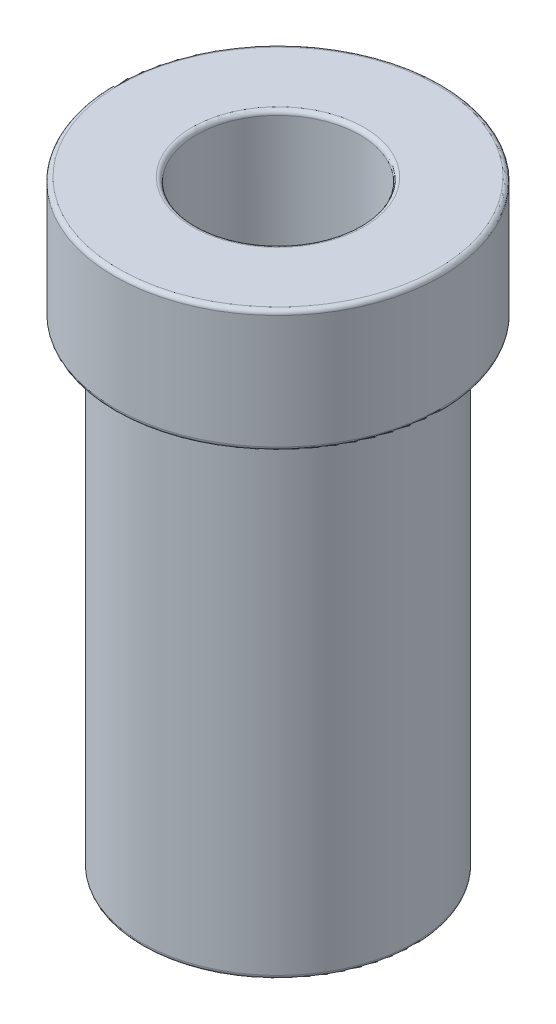
from build123d import *

# Parameters (mm, degrees)
SKETCH2_R          = 0.09375
CUT_EXTRUDE1_DEPTH = 1.736864133
FILLET1_R          = 0.005


with BuildPart() as part:
    # Sketch1 → Revolve1 (revolve)
    with BuildSketch(Plane.XY, mode=Mode.PRIVATE) as revolve1_sk:
        Polygon((0, -0.6875), (0.15625, -0.6875), (0.15625, -0.140625), (0.1875, -0.140625), (0.1875, 0), (0, 0), align=None)
    revolve(revolve1_sk.sketch.rotate(Axis((0, 0, 0), (0, -1, 0)), 90), axis=Axis((0, 0, 0), (0, -1, 0)))

    # Sketch2 → Cut-Extrude1 (cut, through all)
    with BuildSketch(Plane(origin=(0, 0, 0), x_dir=(1, 0, 0), z_dir=(0, 1, 0))):
        with Locations(Location((0, 0, 0), (0, 0, 270))):
            Circle(SKETCH2_R)
    extrude(amount=-CUT_EXTRUDE1_DEPTH, mode=Mode.SUBTRACT)

    # Fillet1
    fillet1_edges = [part.edges().sort_by_distance(p)[0] for p in [
        (0, 0, -0.09375),
        (0, 0, -0.1875),
        (0, -0.140625, -0.1875),
        (0, -0.140625, -0.15625),
        (0, -0.6875, -0.15625),
    ]]
    fillet(fillet1_edges, radius=FILLET1_R)


solid = part.part
